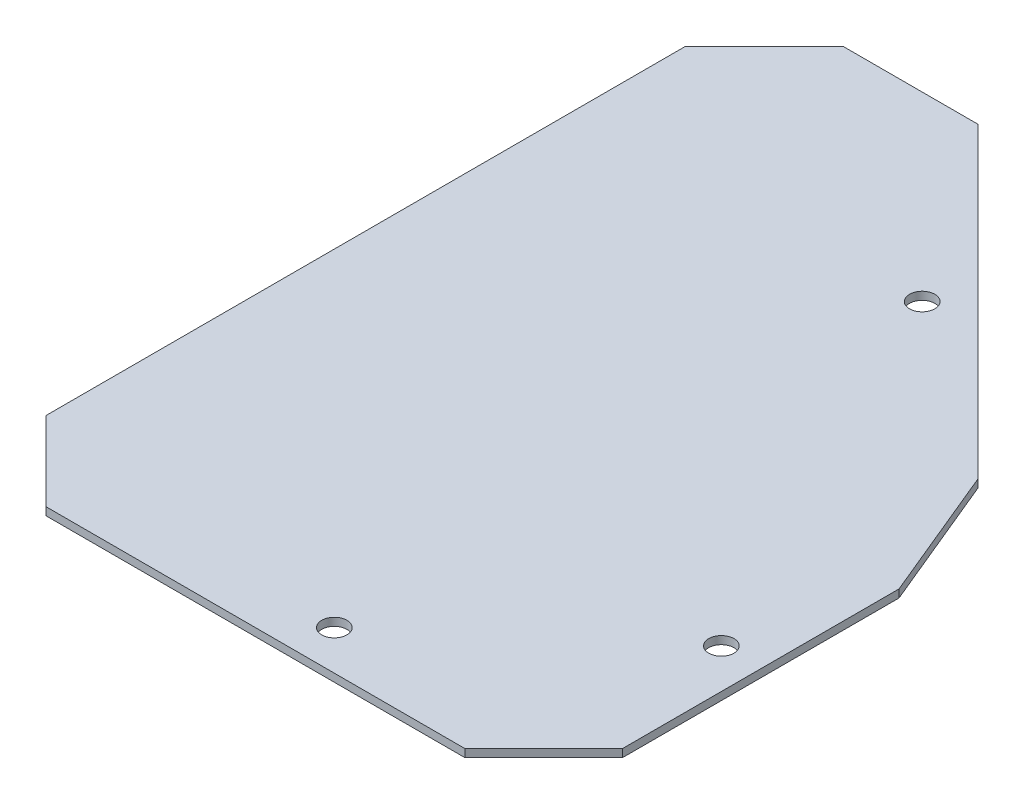
from build123d import *
from OCP.BRepFilletAPI import BRepFilletAPI_MakeChamfer

# Parameters (mm, degrees)
EXTRUDE_1_DEPTH     = 1
CHAMFER_1_SIZE      = 10
CHAMFER_1_SIZE2     = 7.071067812
CHAMFER_2_SIZE      = 10
SKETCH_3_R          = 1.6
CUT_EXTRUDE_2_DEPTH = 10
SKETCH_4_W          = 20
SKETCH_4_H          = 100.961940777
EXTRUDE_2_DEPTH     = 1
CHAMFER_3_SIZE      = 10


with BuildPart() as part:
    # 草图1 → 凸台-拉伸1 (new body)
    with BuildSketch(Plane(origin=(0, 0, 0), x_dir=(1, 0, 0), z_dir=(0, 1, 0))):
        Polygon((0, 0), (53.033008589, 0), (53.033008589, 55), (0, 108.033008589), align=None)
    extrude(amount=EXTRUDE_1_DEPTH)

    # 倒角1: one chamfer whose edges measure the first distance from different faces: ONE call of the kernel's chamfer builder (chamfer() names one face for all edges)
    chamfer_1_edges_1 = [part.edges().sort_by_distance(p)[0] for p in [
        (0, 0.5, -108.033008589),
    ]]
    chamfer_1_side_1 = [part.faces().sort_by_distance(p)[0] for p in [
        (26.516504294, 0.5, -81.516504294),
    ]]
    chamfer_1_edges_2 = [part.edges().sort_by_distance(p)[0] for p in [
        (53.033008589, 0.5, 0),
    ]]
    chamfer_1 = BRepFilletAPI_MakeChamfer(part.part.solid().wrapped)
    for e in chamfer_1_edges_1:
        chamfer_1.Add(CHAMFER_1_SIZE, CHAMFER_1_SIZE2, e.wrapped, chamfer_1_side_1[0].wrapped)  # the first distance lies on this face
    for e in chamfer_1_edges_2:
        chamfer_1.Add(CHAMFER_1_SIZE, e.wrapped)
    add(Compound.cast(chamfer_1.Shape()), mode=Mode.REPLACE)

    # 倒角2
    chamfer_2_edges = [part.edges().sort_by_distance(p)[0] for p in [
        (53.033008589, 0.5, -55),
    ]]
    chamfer(chamfer_2_edges, length=CHAMFER_2_SIZE)

    # 草图3 → 切除-拉伸2 (cut)
    with BuildSketch(Plane.XZ):
        with Locations(Location((22.980970389, -77.980970389, 0), (0, 0, 270))):
            Circle(SKETCH_3_R)
        with Locations(Location((48.033008589, -27.5, 0), (0, 0, 270))):
            Circle(SKETCH_3_R)
        with Locations(Location((21.516504294, -5, 0), (0, 0, 270))):
            Circle(SKETCH_3_R)
    extrude(amount=-CUT_EXTRUDE_2_DEPTH, mode=Mode.SUBTRACT)

    # 草图4 → 凸台-拉伸2 (add)
    with BuildSketch(Plane.XZ):
        with Locations((-10, -50.480970389)):
            Rectangle(SKETCH_4_W, SKETCH_4_H)
    extrude(amount=-EXTRUDE_2_DEPTH)

    # 倒角3
    chamfer_3_edges = [part.edges().sort_by_distance(p)[0] for p in [
        (-20, 0.5, 0),
        (-20, 0.5, -100.961940777),
    ]]
    chamfer(chamfer_3_edges, length=CHAMFER_3_SIZE)


solid = part.part
